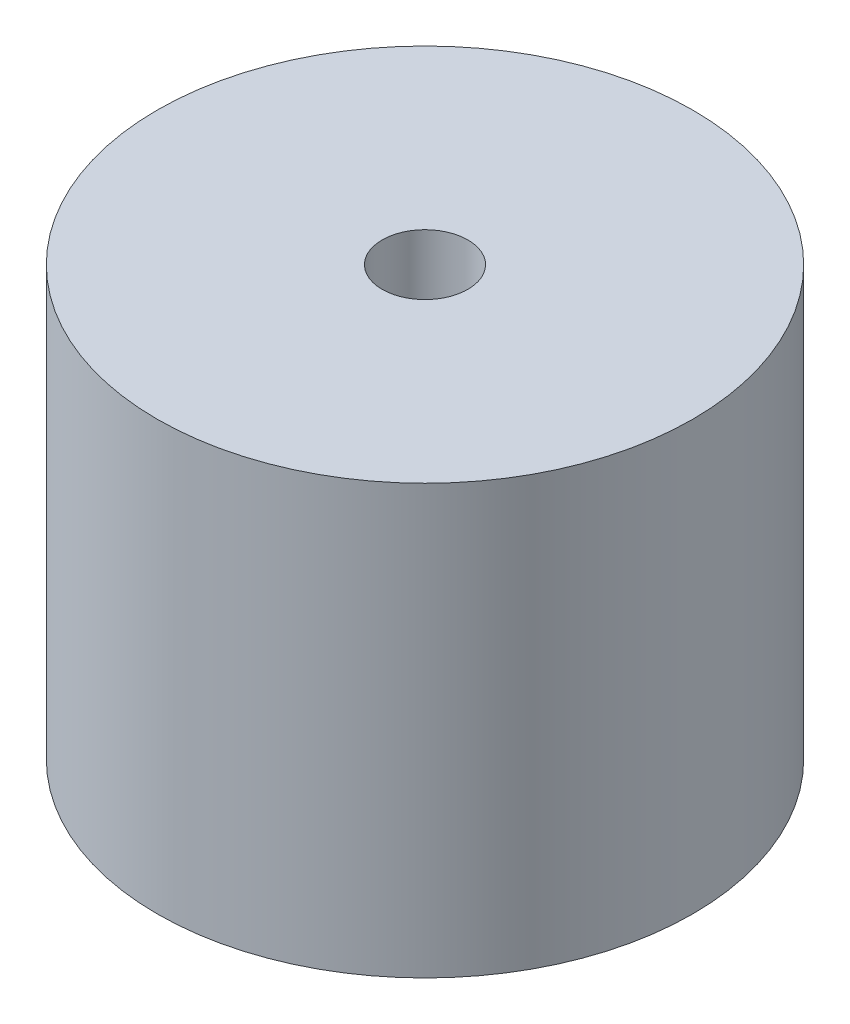
from build123d import *

# Parameters (mm, degrees)
SKETCH_1_R          = 12.5
EXTRUDE_1_DEPTH     = 20
SKETCH_2_R          = 2
CUT_EXTRUDE_1_DEPTH = 8


with BuildPart() as part:
    # 草图1 → 凸台-拉伸1 (new body)
    with BuildSketch(Plane(origin=(0, 0, 0), x_dir=(1, 0, 0), z_dir=(0, 1, 0))):
        with Locations(Location((0, 0, 0), (0, 0, 270))):
            Circle(SKETCH_1_R)
    extrude(amount=EXTRUDE_1_DEPTH)

    # 草图2 → 切除-拉伸1 (cut)
    with BuildSketch(Plane(origin=(0, 20, 0), x_dir=(1, 0, 0), z_dir=(0, 1, 0))):
        with Locations(Location((0, 0, 0), (0, 0, 270))):
            Circle(SKETCH_2_R)
    extrude(amount=-CUT_EXTRUDE_1_DEPTH, mode=Mode.SUBTRACT)


solid = part.part
